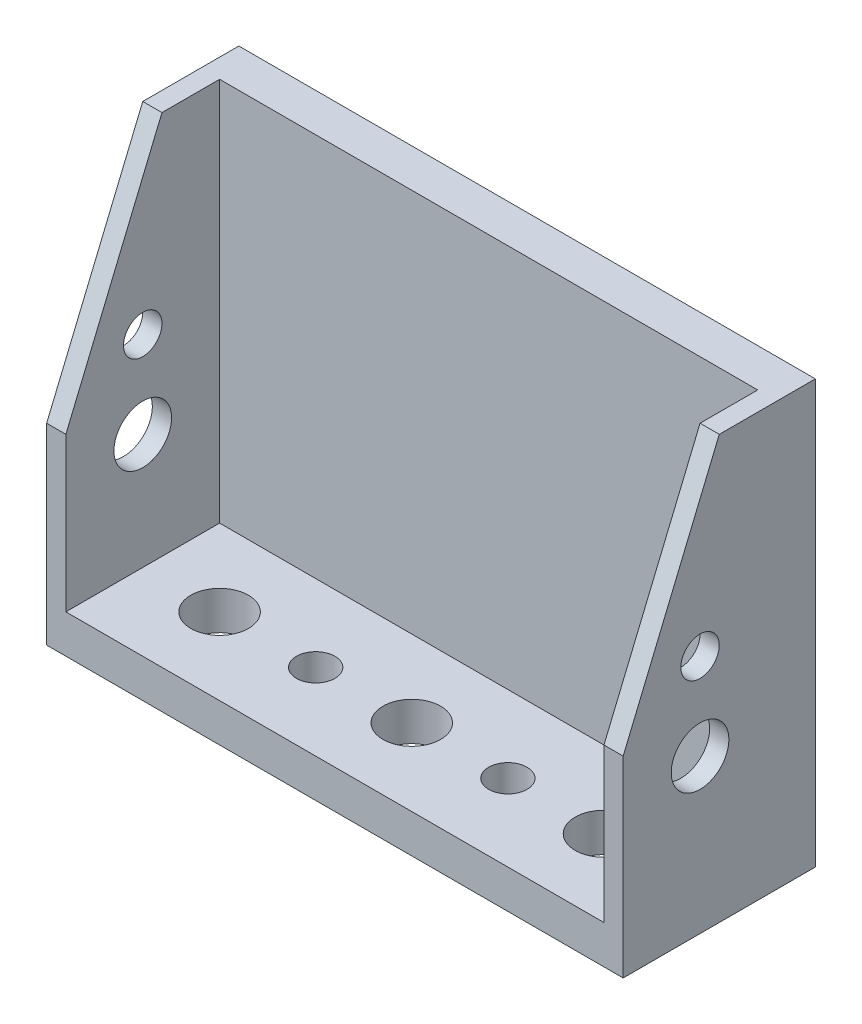
from build123d import *

# Parameters (mm, degrees)
SKETCH1_W           = 30
SKETCH1_H           = 10
BOSS_EXTRUDE1_DEPTH = 2
SKETCH2_W           = 30
SKETCH2_H           = 2
BOSS_EXTRUDE2_DEPTH = 20
BOSS_EXTRUDE3_DEPTH = 1
BOSS_EXTRUDE4_START = -30
BOSS_EXTRUDE4_DEPTH = 1
SKETCH4_R           = 1.5
SKETCH4_R_2         = 1
CUT_EXTRUDE1_DEPTH  = 11
SKETCH5_R           = 1.5
SKETCH5_R_2         = 1
CUT_EXTRUDE2_DEPTH  = 41


with BuildPart() as part:
    # Sketch1 → Boss-Extrude1 (new body)
    with BuildSketch(Plane(origin=(0, 0, 0), x_dir=(1, 0, 0), z_dir=(0, 1, 0))):
        Rectangle(SKETCH1_W, SKETCH1_H)
    extrude(amount=BOSS_EXTRUDE1_DEPTH)

    # Sketch2 → Boss-Extrude2 (add)
    with BuildSketch(Plane(origin=(0, 2, 0), x_dir=(1, 0, 0), z_dir=(0, 1, 0))):
        with Locations((0, 4)):
            Rectangle(SKETCH2_W, SKETCH2_H)
    extrude(amount=BOSS_EXTRUDE2_DEPTH)

    # Sketch3 → Boss-Extrude3 (add)
    with BuildSketch(Plane(origin=(15, 0, 0), x_dir=(0, 0, -1), z_dir=(1, 0, 0))):
        Polygon((-5, 2), (-5, 10), (0, 22), (3, 22), (3, 2), align=None)
    extrude(amount=-BOSS_EXTRUDE3_DEPTH)

    # Sketch3<2> → Boss-Extrude4 (add)
    with BuildSketch(Plane(origin=(15, 0, 0), x_dir=(0, 0, -1), z_dir=(1, 0, 0)).offset(BOSS_EXTRUDE4_START)):
        Polygon((-5, 2), (-5, 10), (0, 22), (3, 22), (3, 2), align=None)
    extrude(amount=BOSS_EXTRUDE4_DEPTH)

    # Sketch4 → Cut-Extrude1 (cut)
    with BuildSketch(Plane.XZ):
        with Locations(Location((0, 1, 0), (0, 0, 270))):
            Circle(SKETCH4_R)
        with Locations(Location((5, 1, 0), (0, 0, 270))):
            Circle(SKETCH4_R_2)
        with Locations(Location((-5, 1, 0), (0, 0, 270))):
            Circle(SKETCH4_R_2)
        with Locations(Location((10, 1, 0), (0, 0, 270))):
            Circle(SKETCH4_R)
        with Locations(Location((-10, 1, 0), (0, 0, 270))):
            Circle(SKETCH4_R)
    extrude(amount=-CUT_EXTRUDE1_DEPTH, mode=Mode.SUBTRACT)

    # Sketch5 → Cut-Extrude2 (cut)
    with BuildSketch(Plane(origin=(15, 0, 0), x_dir=(0, 0, -1), z_dir=(1, 0, 0))):
        with Locations((-1, 8)):
            Circle(SKETCH5_R)
        with Locations((-1, 12.5)):
            Circle(SKETCH5_R_2)
    extrude(amount=-CUT_EXTRUDE2_DEPTH, mode=Mode.SUBTRACT)


solid = part.part
